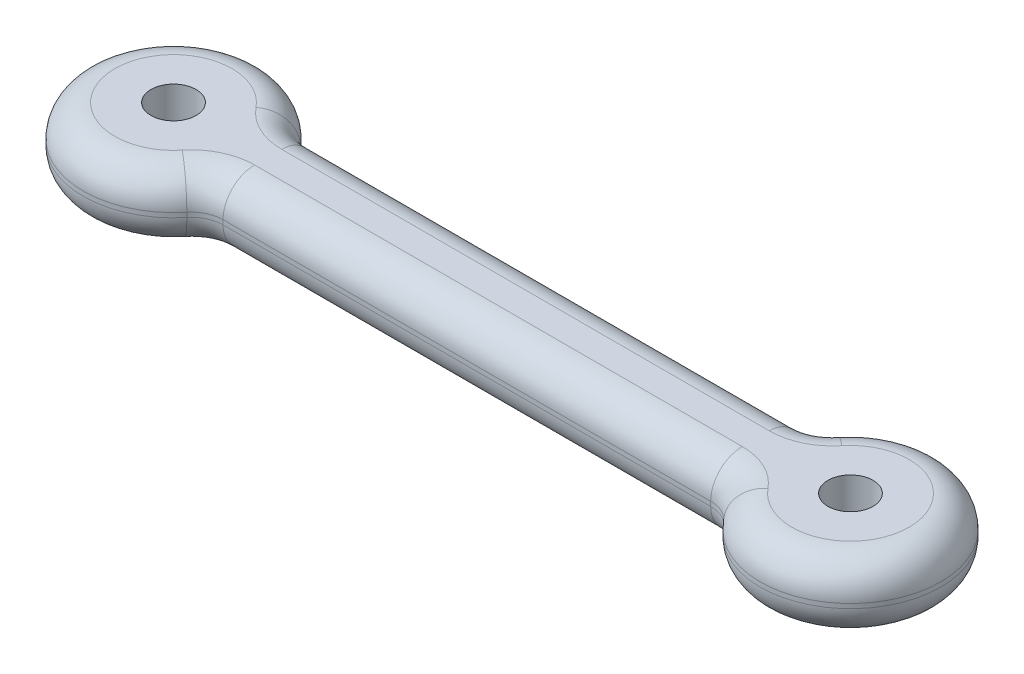
from build123d import *

# Parameters (mm, degrees)
BOSS_EXTRUDE1_DEPTH   = 15
F_1_0MM_DOWEL_HOLE1_D = 10
FILLET1_R             = 7
ESCALA1_SCALE         = 0.2


with BuildPart() as part:
    # Sketch1 → Boss-Extrude1 (new body)
    with BuildSketch(Plane(origin=(0, 0, 0), x_dir=(1, 0, 0), z_dir=(0, 1, 0))):
        with BuildLine():
            Line((57.679491924, 10), (-57.679491924, 10))
            ThreePointArc((-57.679491924, 10), (-95, 0), (-57.679491924, -10))
            Line((-57.679491924, -10), (57.679491924, -10))
            ThreePointArc((57.679491924, -10), (95, 0), (57.679491924, 10))
        make_face()
    extrude(amount=BOSS_EXTRUDE1_DEPTH)

    # Ø1.0mm Dowel Hole1 (through all)
    with Locations(Plane(origin=(0, 15, 0), x_dir=(1, 0, 0), z_dir=(0, 1, 0))):
        with Locations((-75, 0), (75, 0)):
            Hole(F_1_0MM_DOWEL_HOLE1_D / 2)

    # Fillet1
    fillet1_edges = [part.edges().sort_by_distance(p)[0] for p in [
        (95, 15, 0),
        (0, 15, -10),
        (-95, 15, 0),
        (0, 0, -10),
        (95, 0, 0),
        (0, 0, 10),
        (-95, 0, 0),
        (0, 15, 10),
        (-57.679491924, 7.5, -10),
        (57.679491924, 7.5, -10),
        (57.679491924, 7.5, 10),
        (-57.679491924, 7.5, 10),
    ]]
    fillet(fillet1_edges, radius=FILLET1_R)


with BuildPart() as part_1:
    # Escala1: scaled about (0, 7.5, 0)
    add(part.part.scale(ESCALA1_SCALE).moved(Location((0, 6, 0))))


solid = part_1.part
